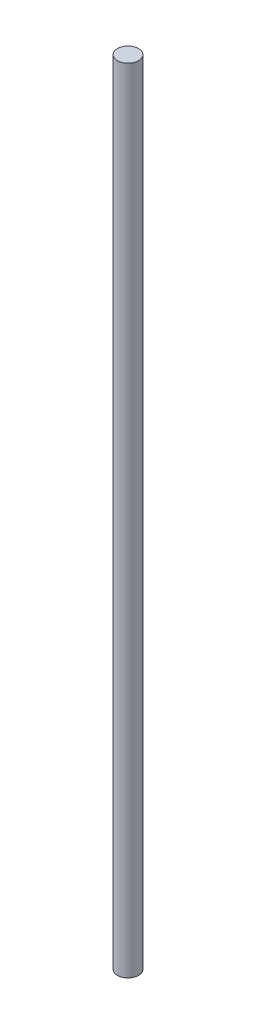
from build123d import *

# Parameters (mm, degrees)
PACK_LINEER_RAY_D16_2_START = 300
SKETCH1_R                   = 8
PACK_LINEER_RAY_D16_2_DEPTH = 600


with BuildPart() as part:
    # Sketch1 → PACK_lineer_ray_D16_2 (new body)
    with BuildSketch(Plane(origin=(0, 0, 0), x_dir=(1, 0, 0), z_dir=(0, 1, 0)).offset(PACK_LINEER_RAY_D16_2_START)):
        with Locations(Location((550, 400, 0), (0, 0, 270))):
            Circle(SKETCH1_R)
    extrude(amount=PACK_LINEER_RAY_D16_2_DEPTH)


solid = part.part
